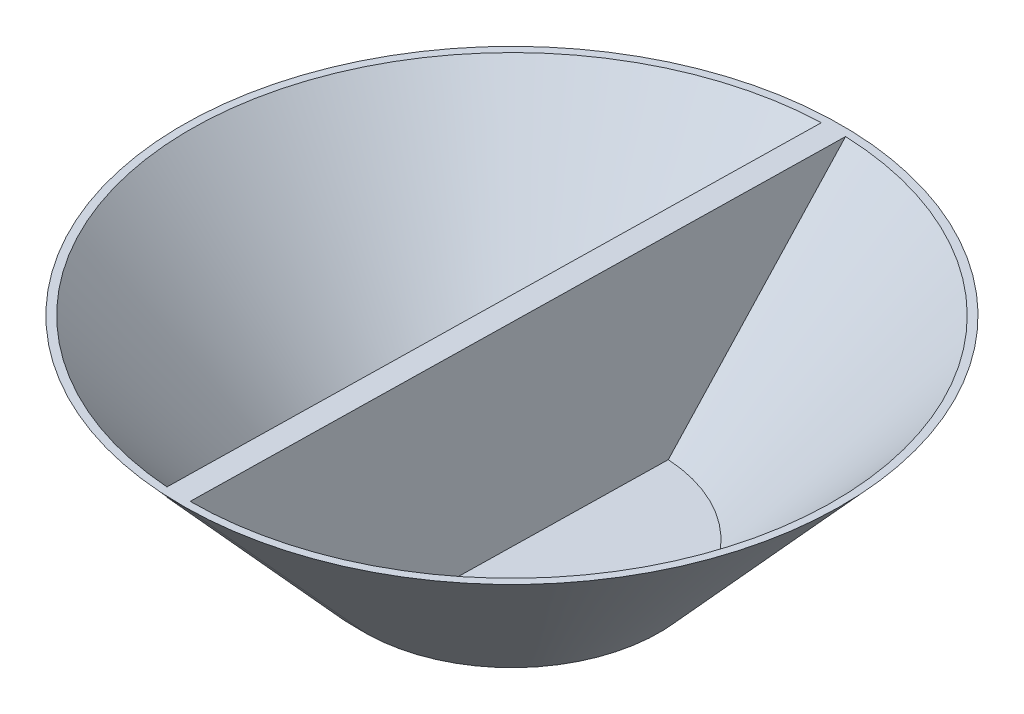
from build123d import *

# Parameters (mm, degrees)
BOSS_EXTRUDE1_DEPTH = 35
CUT_EXTRUDE2_DEPTH  = 10
CUT_EXTRUDE3_DEPTH  = 35
SKETCH7_W           = 1.915857316
SKETCH7_H           = 33.660559038
CUT_EXTRUDE4_DEPTH  = 0.1


with BuildPart() as part:
    # Sketch1 → Revolve1 (revolve)
    with BuildSketch(Plane.XY, mode=Mode.PRIVATE) as revolve1_sk:
        Polygon((373.098534333, 35.069747422), (349.598534333, 35.069747422), (349.598534333, 36.051468212), (373.098534333, 36.051468212), (400.761964989, 66.939755158), (401.975618585, 66.939755158), align=None)
    revolve(revolve1_sk.sketch.rotate(Axis((349.598534333, 66.939755158, 0), (0, -1, 0)), 90), axis=Axis((349.598534333, 66.939755158, 0), (0, -1, 0)))

    # Sketch2 → Boss-Extrude1 (add)
    with BuildSketch(Plane(origin=(0, 66.939755158, 0), x_dir=(1, 0, 0), z_dir=(0, 1, 0))):
        with BuildLine():
            ThreePointArc((351.491870795, 51.128386573), (349.575661264, 51.163425543), (347.659483828, 51.12667327))
            Line((347.659483828, 51.12667327), (345.790974227, -51.02155547))
            ThreePointArc((345.790974227, -51.02155547), (347.704525671, -51.128361676), (349.620734741, -51.16342584))
            Line((349.620734741, -51.16342584), (351.491870795, 51.128386573))
        make_face()
    extrude(amount=-BOSS_EXTRUDE1_DEPTH)

    # Sketch3 → Cut-Extrude2 (cut)
    with BuildSketch(Plane(origin=(350.439365404, 0, 6.410285591), x_dir=(0.018289079495206917, 0, -0.9998327407977887), z_dir=(0.9998327407977886, 0, 0.018289079495206913))):
        Polygon((-44.760626875, 65.600314196), (-17.086632512, 35.069747422), (29.874303283, 35.069747422), (57.548297647, 65.600314196), (57.842029456, 31.939755158), (-44.760626875, 31.939755158), align=None)
    extrude(amount=-CUT_EXTRUDE2_DEPTH, mode=Mode.SUBTRACT)

    # Sketch6 → Cut-Extrude3 (cut)
    with BuildSketch(Plane(origin=(0, 66.939755158, 0), x_dir=(1, 0, 0), z_dir=(0, 1, 0))):
        Polygon((350.109498728, -52.374591838), (349.598534333, -52.377084252), (349.598534333, -53.887685529), (342.379231724, -53.887685529), (345.988883028, -52.252553739), align=None)
    extrude(amount=-CUT_EXTRUDE3_DEPTH, mode=Mode.SUBTRACT)


with BuildPart() as cut_extrude3_kept_piece:
    # of the separate pieces the step leaves, the one the design keeps (cut_extrude3_pieces_kept)
    add(part.part.solids().sort_by_distance((350.985738912, 35.069747422, -23.45902094))[0])

    # Sketch7 → Cut-Extrude4 (cut)
    with BuildSketch(Plane(origin=(-0.818630663, 0, 44.753140248), x_dir=(-0.9998327407977887, 0, -0.01828907949520692), z_dir=(0.018289079495206917, 0, -0.9998327407977886))):
        with Locations((-349.540060761, 48.770034677)):
            Rectangle(SKETCH7_W, SKETCH7_H)
    extrude(amount=-CUT_EXTRUDE4_DEPTH, mode=Mode.SUBTRACT)


solid = cut_extrude3_kept_piece.part
